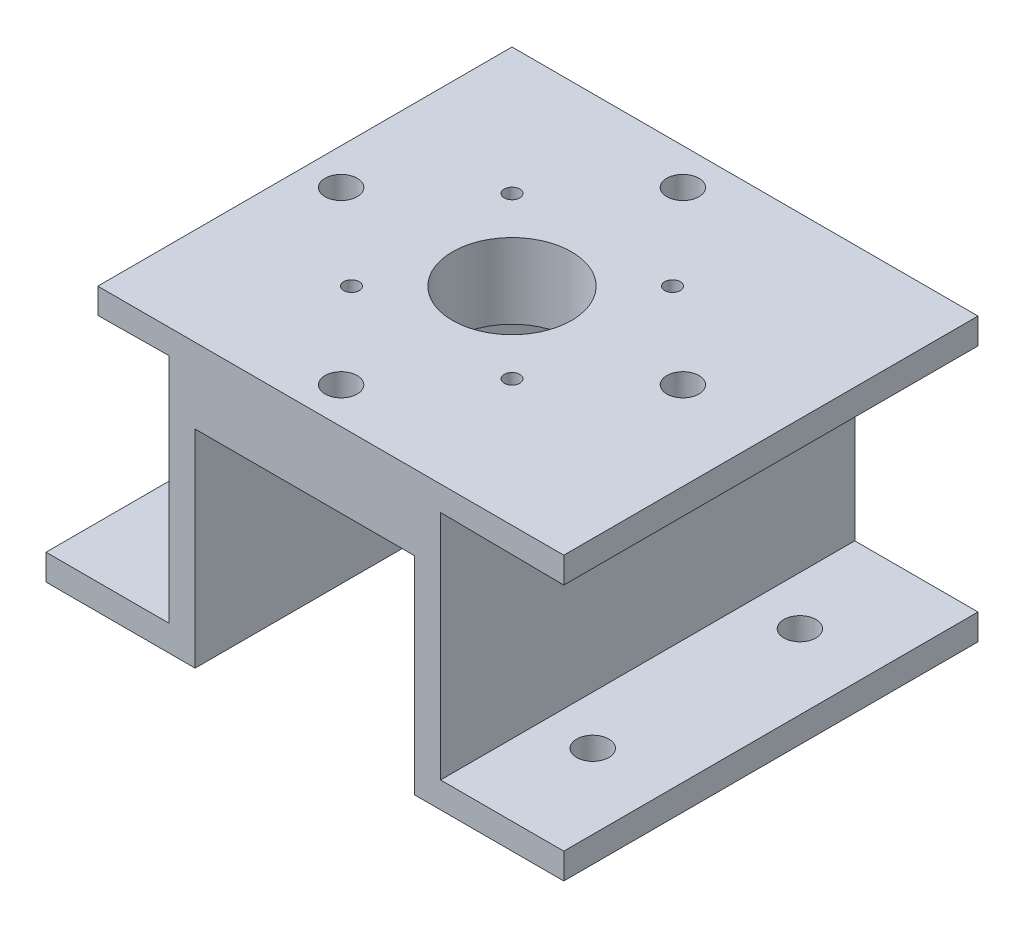
from build123d import *

# Parameters (mm, degrees)
BOSS_EXTRUDE3_DEPTH = 40
SKETCH4_R           = 11.5
SKETCH4_R_2         = 1.5
CUT_EXTRUDE1_DEPTH  = 80
SKETCH5_R           = 3.1
CUT_EXTRUDE2_DEPTH  = 40
SKETCH9_R           = 3.1
CUT_EXTRUDE3_DEPTH  = 10
SKETCH11_W          = 10
SKETCH11_H          = 80
CUT_EXTRUDE4_DEPTH  = 10


with BuildPart() as part:
    # Sketch1 → Boss-Extrude3 (new, symmetric)
    with BuildSketch(Plane.XY):
        Polygon((0, 0), (21.2, 0), (21.2, -40), (50, -40), (50, -35), (26.2, -35), (26.2, 5), (26.2, 9.75), (50, 9.5), (50, 14.5), (26.15, 14.5), (-26.15, 14.5), (-50, 14.5), (-50, 9.5), (-26.2, 9.75), (-26.2, 5), (-26.2, -35), (-50, -35), (-50, -40), (-21.2, -40), (-21.2, 0), align=None)
    extrude(amount=BOSS_EXTRUDE3_DEPTH, both=True)

    # Sketch4 → Cut-Extrude1 (cut)
    with BuildSketch(Plane(origin=(0, 14.5, 0), x_dir=(1, 0, 0), z_dir=(0, 1, 0))):
        with Locations(Location((0, 0, 0), (0, 0, 270))):
            Circle(SKETCH4_R)
        with Locations(Location((-15.5, 15.5, 0), (0, 0, 270))):
            Circle(SKETCH4_R_2)
        with Locations(Location((-15.5, -15.5, 0), (0, 0, 270))):
            Circle(SKETCH4_R_2)
        with Locations(Location((15.5, -15.5, 0), (0, 0, 270))):
            Circle(SKETCH4_R_2)
        with Locations(Location((15.5, 15.5, 0), (0, 0, 270))):
            Circle(SKETCH4_R_2)
    extrude(amount=-CUT_EXTRUDE1_DEPTH, mode=Mode.SUBTRACT)

    # Sketch5 → Cut-Extrude2 (cut)
    with BuildSketch(Plane(origin=(0, 14.5, 0), x_dir=(1, 0, 0), z_dir=(0, 1, 0))):
        with Locations(Location((33, 0, 0), (0, 0, 270))):
            Circle(SKETCH5_R)
        with Locations(Location((0, -33, 0), (0, 0, 270))):
            Circle(SKETCH5_R)
        with Locations(Location((-33, 0, 0), (0, 0, 270))):
            Circle(SKETCH5_R)
        with Locations(Location((0, 33, 0), (0, 0, 270))):
            Circle(SKETCH5_R)
    extrude(amount=-CUT_EXTRUDE2_DEPTH, mode=Mode.SUBTRACT)

    # Sketch9 → Cut-Extrude3 (cut)
    with BuildSketch(Plane.XZ.offset(40)):
        with Locations(Location((35.6, 20, 0), (0, 0, 270))):
            Circle(SKETCH9_R)
        with Locations(Location((35.6, -20, 0), (0, 0, 270))):
            Circle(SKETCH9_R)
        with Locations(Location((-35.6, -20, 0), (0, 0, 270))):
            Circle(SKETCH9_R)
        with Locations(Location((-35.6, 20, 0), (0, 0, 270))):
            Circle(SKETCH9_R)
    extrude(amount=-CUT_EXTRUDE3_DEPTH, mode=Mode.SUBTRACT)

    # Sketch11 → Cut-Extrude4 (cut)
    with BuildSketch(Plane(origin=(0, 14.5, 0), x_dir=(1, 0, 0), z_dir=(0, 1, 0))):
        with Locations((-45, 0)):
            Rectangle(SKETCH11_W, SKETCH11_H)
    extrude(amount=-CUT_EXTRUDE4_DEPTH, mode=Mode.SUBTRACT)


solid = part.part
